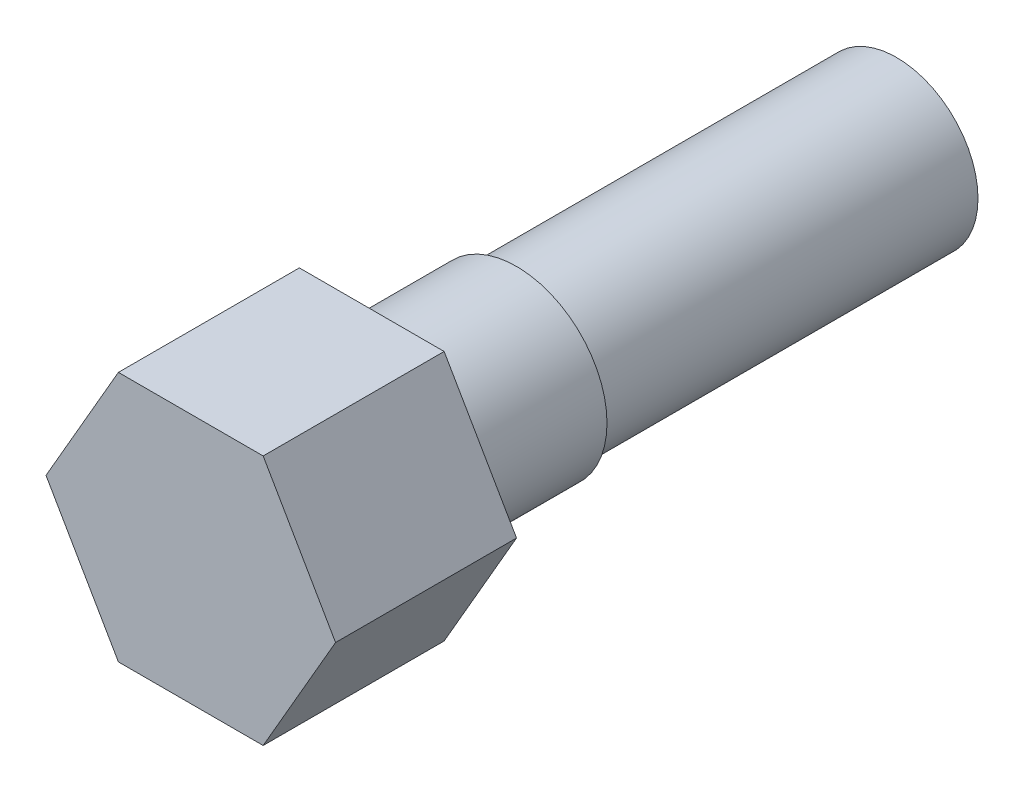
from build123d import *

# Parameters (mm, degrees)
EXTRUDE_1_DEPTH     = 10
SKETCH_3_R          = 4.5
SKETCH_3_R_2        = 2.5
EXTRUDE_2_DEPTH     = 120
SKETCH_5_R          = 5
SKETCH_5_R_2        = 4.5
EXTRUDE_3_DEPTH     = 45
SKETCH_6_R          = 4.5
SKETCH_6_R_2        = 2.5
EXTRUDE_5_DEPTH     = 25
CUT_EXTRUDE_START   = -100
SKETCH_7_R          = 4.5
CUT_EXTRUDE_1_DEPTH = 100
CUT_EXTRUDE_START_2 = -33
SKETCH_9_R          = 5
CUT_EXTRUDE_2_DEPTH = 33
SKETCH_8_R          = 4.5
EXTRUDE_6_DEPTH     = 29
CUT_EXTRUDE_START_3 = -4
SKETCH_10_R         = 5
SKETCH_10_R_2       = 4.5
CUT_EXTRUDE_3_DEPTH = 4


with BuildPart() as part:
    # 草图1 → 凸台-拉伸1 (new body)
    with BuildSketch(Plane.XY):
        Polygon((8, 0), (4, 6.92820323), (-4, 6.92820323), (-8, 0), (-4, -6.92820323), (4, -6.92820323), align=None)
    extrude(amount=EXTRUDE_1_DEPTH)

    # 草图3 → 凸台-拉伸2 (add)
    with BuildSketch(Plane(origin=(0, 0, 0), x_dir=(-1, 0, 0), z_dir=(0, 0, -1))):
        with Locations(Location((0, 0, 0), (0, 0, 180))):
            Circle(SKETCH_3_R)
        Circle(SKETCH_3_R_2, mode=Mode.SUBTRACT)
    extrude(amount=EXTRUDE_2_DEPTH)

    # 草图5 → 凸台-拉伸3 (add)
    with BuildSketch(Plane(origin=(0, 0, 0), x_dir=(-1, 0, 0), z_dir=(0, 0, -1))):
        with Locations(Location((0, 0, 0), (0, 0, 180))):
            Circle(SKETCH_5_R)
        Circle(SKETCH_5_R_2, mode=Mode.SUBTRACT)
    extrude(amount=EXTRUDE_3_DEPTH)

    # 草图6 → 凸台-拉伸5 (add)
    with BuildSketch(Plane(origin=(0, 0, -120), x_dir=(-1, 0, 0), z_dir=(0, 0, -1))):
        Circle(SKETCH_6_R)
        Circle(SKETCH_6_R_2, mode=Mode.SUBTRACT)
    extrude(amount=EXTRUDE_5_DEPTH)

    # 草图7 → 切除-拉伸1 (cut)
    with BuildSketch(Plane(origin=(0, 0, -145), x_dir=(-1, 0, 0), z_dir=(0, 0, -1)).offset(CUT_EXTRUDE_START)):
        Circle(SKETCH_7_R)
    extrude(amount=CUT_EXTRUDE_1_DEPTH, mode=Mode.SUBTRACT)

    # 草图9 → 切除-拉伸2 (cut)
    with BuildSketch(Plane(origin=(0, 0, -45), x_dir=(-1, 0, 0), z_dir=(0, 0, -1)).offset(CUT_EXTRUDE_START_2)):
        with Locations(Location((0, 0, 0), (0, 0, 180))):
            Circle(SKETCH_9_R)
    extrude(amount=CUT_EXTRUDE_2_DEPTH, mode=Mode.SUBTRACT)

    # 草图8 → 凸台-拉伸6 (add)
    with BuildSketch(Plane(origin=(0, 0, 0), x_dir=(-1, 0, 0), z_dir=(0, 0, -1))):
        with Locations(Location((0, 0, 0), (0, 0, 180))):
            Circle(SKETCH_8_R)
    extrude(amount=EXTRUDE_6_DEPTH)

    # 草图10 → 切除-拉伸3 (cut)
    with BuildSketch(Plane(origin=(0, 0, -12), x_dir=(-1, 0, 0), z_dir=(0, 0, -1)).offset(CUT_EXTRUDE_START_3)):
        with Locations(Location((0, 0, 0), (0, 0, 180))):
            Circle(SKETCH_10_R)
        with Locations(Location((0, 0, 0), (0, 0, 180))):
            Circle(SKETCH_10_R_2, mode=Mode.SUBTRACT)
    extrude(amount=CUT_EXTRUDE_3_DEPTH, mode=Mode.SUBTRACT)


solid = part.part
